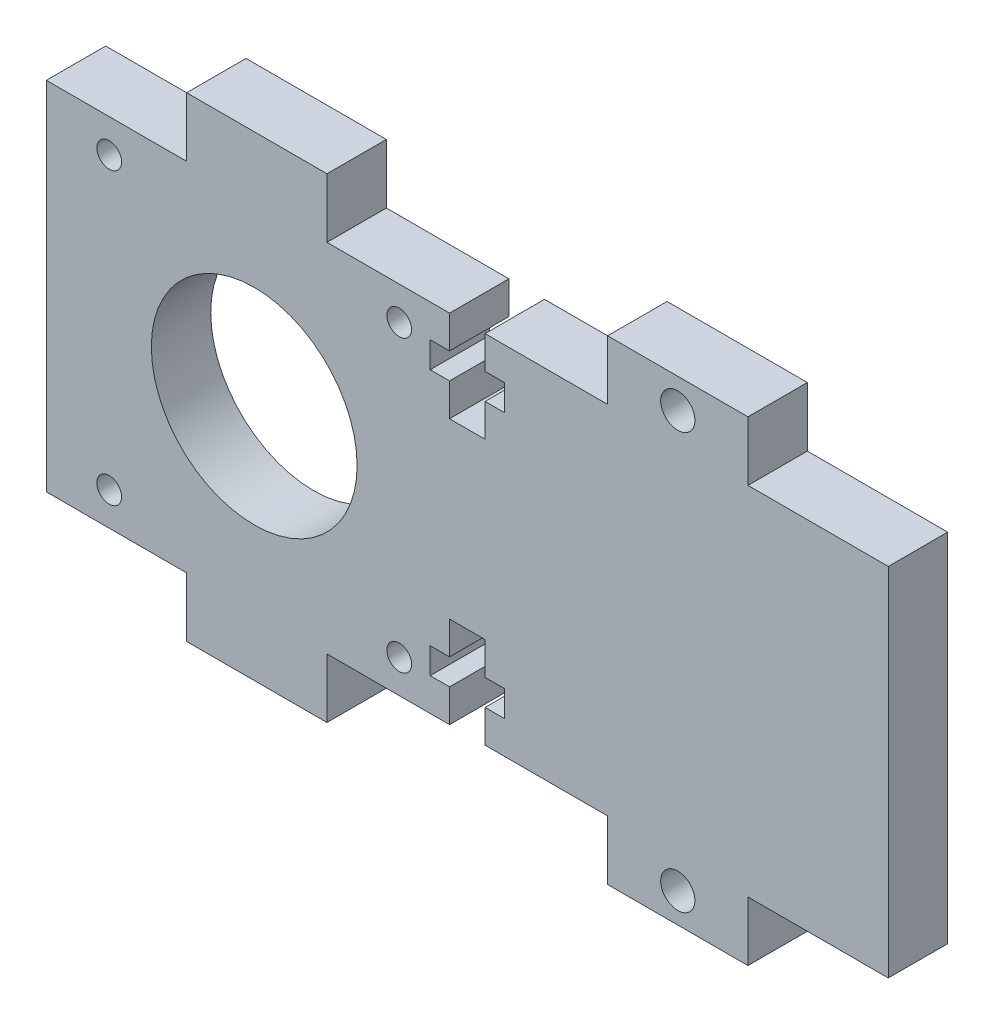
from build123d import *

# Parameters (mm, degrees)
SKETCH1_W             = 90
SKETCH1_H             = 50.8
BOSS_EXTRUDE1_DEPTH   = 6.35
SKETCH2_R             = 7.9375
SKETCH2_W             = 15
SKETCH2_H             = 6.35
SKETCH2_W_2           = 30
CUT_EXTRUDE1_DEPTH    = 6.35
CUT_EXTRUDE3_DEPTH    = 53.062294417
SKETCH3_R             = 11
SKETCH3_R_2           = 1.3208
CUT_EXTRUDE2_DEPTH    = 53.062294417
F_6_CLEARANCE_HOLE1_D = 3.6576


with BuildPart() as part:
    # Sketch1 → Boss-Extrude1 (new body)
    with BuildSketch(Plane.XY):
        Rectangle(SKETCH1_W, SKETCH1_H)
    extrude(amount=BOSS_EXTRUDE1_DEPTH)

    # Sketch2 → Cut-Extrude1 (cut)
    with BuildSketch(Plane.XY.offset(6.35)):
        with Locations((-22.775, 0)):
            Circle(SKETCH2_R)
        with Locations((-37.5, -22.225)):
            Rectangle(SKETCH2_W, SKETCH2_H)
        with Locations((0, -22.225)):
            Rectangle(SKETCH2_W_2, SKETCH2_H)
        with Locations((37.5, -22.225)):
            Rectangle(SKETCH2_W, SKETCH2_H)
    cut_extrude1 = extrude(amount=-CUT_EXTRUDE1_DEPTH, mode=Mode.SUBTRACT)

    # Sketch9 → Cut-Extrude3 (cut, through all)
    with BuildSketch(Plane.XY.offset(6.35)):
        Polygon((-1.89865, -9.271), (1.89865, -9.271), (1.89865, -12.7714375), (3.96875, -12.7714375), (3.96875, -15.5495625), (1.89865, -15.5495625), (1.89865, -19.05), (-1.89865, -19.05), (-1.89865, -15.5495625), (-3.96875, -15.5495625), (-3.96875, -12.7714375), (-1.89865, -12.7714375), align=None)
    cut_extrude3 = extrude(amount=-CUT_EXTRUDE3_DEPTH, mode=Mode.SUBTRACT)

    # Mirror2: Cut-Extrude1, Cut-Extrude3 across plane
    add(cut_extrude1.mirror(Plane.ZX), mode=Mode.SUBTRACT)
    add(cut_extrude3.mirror(Plane.ZX), mode=Mode.SUBTRACT)

    # Sketch3 → Cut-Extrude2 (cut, through all)
    with BuildSketch(Plane.XY.offset(6.35)):
        with Locations((-22.775, 0)):
            Circle(SKETCH3_R)
        with Locations((-38.275, 15.5)):
            Circle(SKETCH3_R_2)
        with Locations((-7.275, 15.5)):
            Circle(SKETCH3_R_2)
        with Locations((-7.275, -15.5)):
            Circle(SKETCH3_R_2)
        with Locations((-38.275, -15.5)):
            Circle(SKETCH3_R_2)
    extrude(amount=-CUT_EXTRUDE2_DEPTH, mode=Mode.SUBTRACT)

    # #6 Clearance Hole1 (through all)
    with Locations(Plane.XY.offset(6.35)):
        with Locations((22.5, -22.225)):
            f_6_clearance_hole1 = Hole(F_6_CLEARANCE_HOLE1_D / 2)

    # Mirror3: #6 Clearance Hole1 across plane
    add(f_6_clearance_hole1.mirror(Plane.ZX), mode=Mode.SUBTRACT)


solid = part.part
